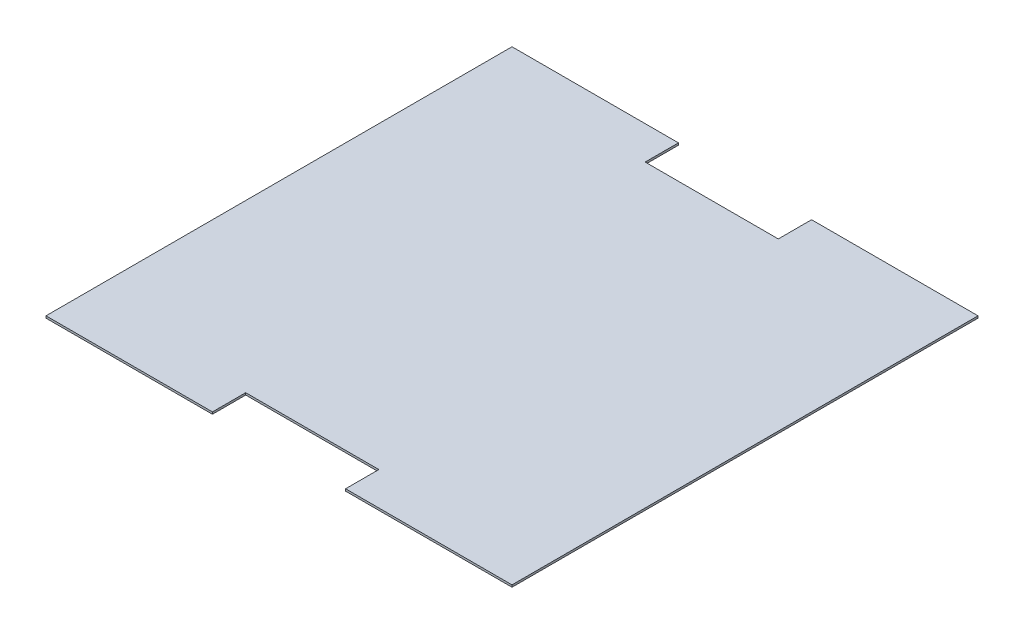
from build123d import *

# Parameters (mm, degrees)
SKETCH1_W           = 711.2
SKETCH1_H           = 711.2
BOSS_EXTRUDE1_DEPTH = 3.175
SKETCH2_W           = 203.2
SKETCH2_H           = 50.8
CUT_EXTRUDE1_DEPTH  = 1140.039146393


with BuildPart() as part:
    # Sketch1 → Boss-Extrude1 (new body)
    with BuildSketch(Plane(origin=(0, 0, 0), x_dir=(1, 0, 0), z_dir=(0, 1, 0))):
        with Locations((693.334645702, -88.400231346)):
            Rectangle(SKETCH1_W, SKETCH1_H)
    extrude(amount=BOSS_EXTRUDE1_DEPTH)

    # Sketch2 → Cut-Extrude1 (cut, through all)
    with BuildSketch(Plane(origin=(0, 3.175, 0), x_dir=(1, 0, 0), z_dir=(0, 1, 0))):
        with Locations((693.334645702, 241.799768654)):
            Rectangle(SKETCH2_W, SKETCH2_H)
        with Locations((693.334645702, -418.600231346)):
            Rectangle(SKETCH2_W, SKETCH2_H)
    extrude(amount=-CUT_EXTRUDE1_DEPTH, mode=Mode.SUBTRACT)


solid = part.part
